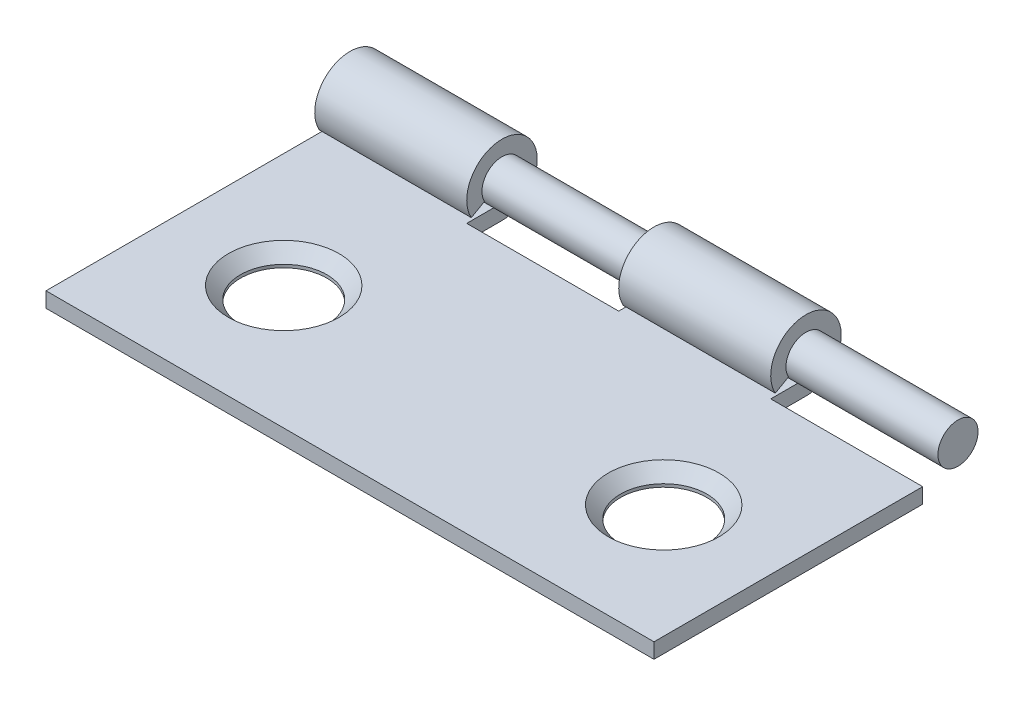
from build123d import *

# Parameters (mm, degrees)
BOSS_EXTRUDE1_DEPTH     = 12.7
SKETCH4_W               = 6.35
SKETCH4_H               = 2.9464
CUT_EXTRUDE1_DEPTH      = 19.020830121
LPATTERN1_COUNT         = 6
LPATTERN1_PITCH         = 12.7
CUT_EXTRUDE3_DEPTH      = 19.020830121
CUT_EXTRUDE3_DEPTH_BACK = 19.020830121
SKETCH9_R               = 1.8034
SKETCH6_R               = 0.8382
BOSS_EXTRUDE2_DEPTH     = 12.7


with BuildPart() as part:
    # Sketch3 → Boss-Extrude1 (new, symmetric)
    with BuildSketch(Plane(origin=(0, 0, 0), x_dir=(0, 0, -1), z_dir=(1, 0, 0))):
        with BuildLine():
            Line((0, -1.4732), (-12.7, -1.4732))
            Line((-12.7, -1.4732), (-12.7, -0.8382))
            Line((-12.7, -0.8382), (0, -0.8382))
            ThreePointArc((0, -0.8382), (0.421388638, 0.724576328), (-0.728533124, -0.414510226))
            Line((-0.728533124, -0.414510226), (-1.280452157, -0.728533124))
            ThreePointArc((-1.280452157, -0.728533124), (0.740622455, 1.273497789), (0, -1.4732))
        make_face()
    extrude(amount=BOSS_EXTRUDE1_DEPTH, both=True)

    # Sketch4 → Cut-Extrude1 (cut, symmetric)
    with BuildSketch(Plane(origin=(0, 0, 0), x_dir=(1, 0, 0), z_dir=(0, 1, 0))):
        with Locations((-3.175, 0)):
            Rectangle(SKETCH4_W, SKETCH4_H)
    cut_extrude1 = extrude(amount=CUT_EXTRUDE1_DEPTH, both=True, mode=Mode.SUBTRACT)

    # LPattern1: Cut-Extrude1 ×6
    with Locations(*[(i * LPATTERN1_PITCH, 0, 0) for i in range(1, LPATTERN1_COUNT)]):
        add(cut_extrude1, mode=Mode.SUBTRACT)

    # Cut-Extrude2 cone 1 section (through the dimple's axis) → Cut-Extrude2 (revolve, cut)
    with BuildSketch(Plane(origin=(7.9502, -0.8382, 7.5438), x_dir=(0, 0, 1), z_dir=(1, 0, 0))):
        Polygon((0, 0), (2.3114, 0), (0, 2.3114), align=None)
    revolve(axis=Axis((7.9502, -0.8382, 7.5438), (0, -1, 0)), mode=Mode.SUBTRACT)

    # Cut-Extrude2 cone 2 section (through the dimple's axis) → Cut-Extrude2 cone 2 (revolve, cut)
    with BuildSketch(Plane(origin=(-7.9248, -0.8382, 7.5438), x_dir=(0, 0, 1), z_dir=(1, 0, 0))):
        Polygon((0, 0), (2.3114, 0), (0, 2.3114), align=None)
    revolve(axis=Axis((-7.9248, -0.8382, 7.5438), (0, -1, 0)), mode=Mode.SUBTRACT)

    # Sketch9 → Cut-Extrude3 (cut, two sides: drawn at the far end of the back side and taken through both)
    with BuildSketch(Plane(origin=(0, 0, 0), x_dir=(1, 0, 0), z_dir=(0, 1, 0)).offset(-CUT_EXTRUDE3_DEPTH_BACK)):
        with Locations(Location((7.9502, -7.5438, 0), (0, 0, 270))):
            Circle(SKETCH9_R)
        with Locations(Location((-7.9248, -7.5438, 0), (0, 0, 270))):
            Circle(SKETCH9_R)
    extrude(amount=CUT_EXTRUDE3_DEPTH + CUT_EXTRUDE3_DEPTH_BACK, mode=Mode.SUBTRACT)


with BuildPart() as body_2:
    # Sketch6 → Boss-Extrude2 (new, symmetric)
    with BuildSketch(Plane(origin=(0, 0, 0), x_dir=(0, 0, -1), z_dir=(1, 0, 0))):
        with Locations(Location((0, 0, 0), (0, 0, 180))):
            Circle(SKETCH6_R)
    extrude(amount=BOSS_EXTRUDE2_DEPTH, both=True)


solid = Compound([part.part, body_2.part])
